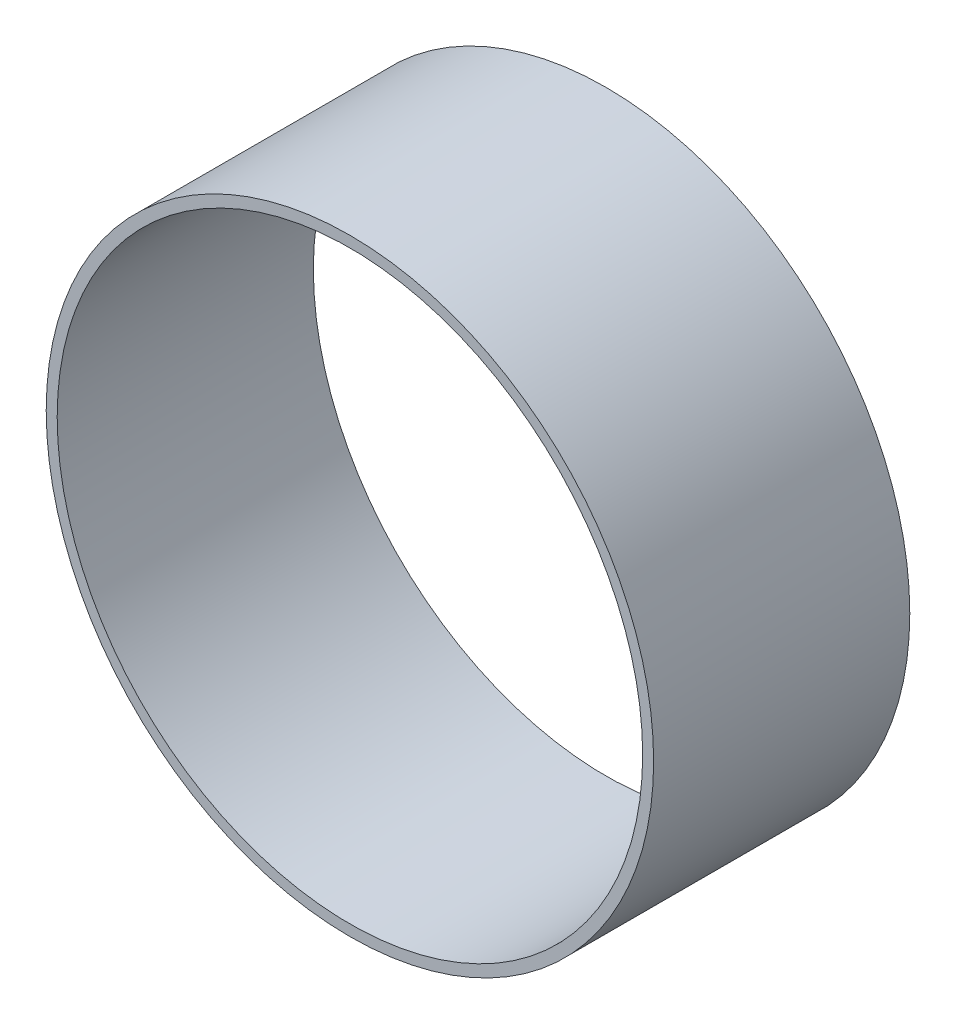
from build123d import *

# Parameters (mm, degrees)
ROTOR_SHELL_START = -35
SKETCH_1_R        = 83
SKETCH_1_R_2      = 80
ROTOR_SHELL_DEPTH = 70


with BuildPart() as part:
    # Эскиз1 → Rotor_shell (new body)
    with BuildSketch(Plane.XY.offset(ROTOR_SHELL_START)):
        Circle(SKETCH_1_R)
        Circle(SKETCH_1_R_2, mode=Mode.SUBTRACT)
    extrude(amount=ROTOR_SHELL_DEPTH)


solid = part.part
